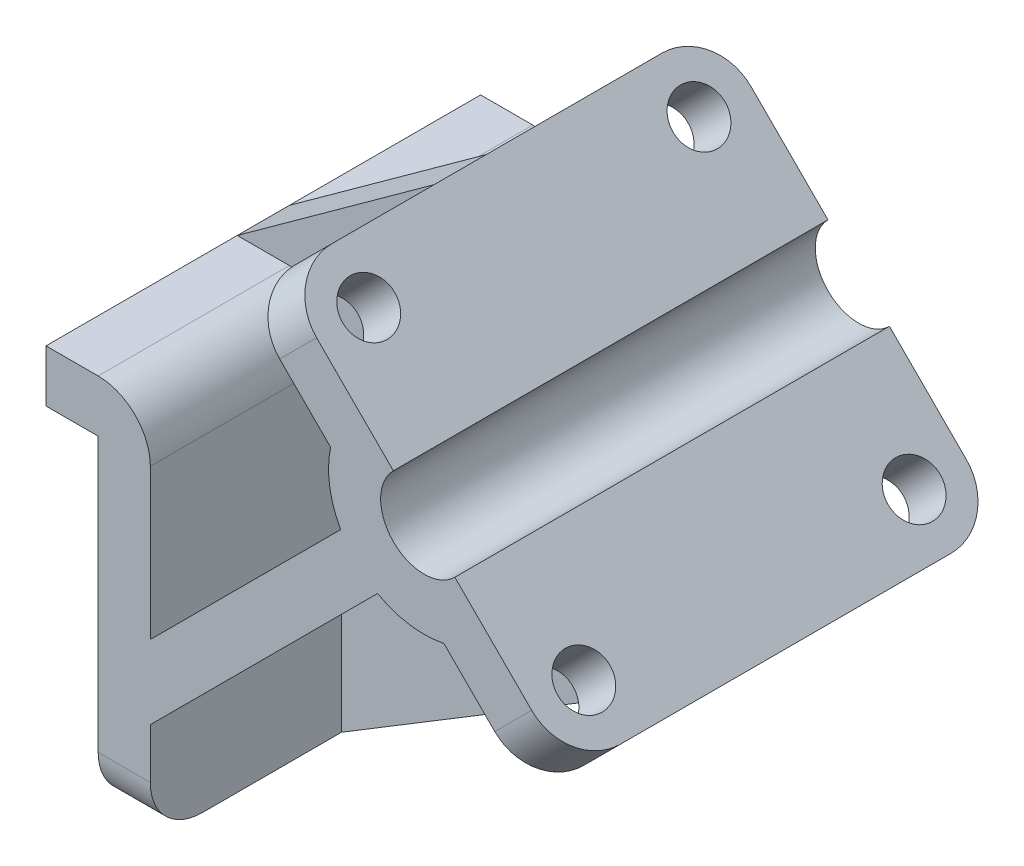
from build123d import *

# Parameters (mm, degrees)
BOSS_EXTRUDE1_DEPTH = 50
SKETCH2_R           = 6
CUT_EXTRUDE1_DEPTH  = 12
FILLET1_R           = 12
FILLET2_R           = 12
RIB3_REACH          = 169.943
SKETCH14_WALL_W     = 393.768799168
SKETCH14_WALL_H     = 12
RIB5_REACH          = 169.943
SKETCH15_WALL_W     = 440.544630956
SKETCH15_WALL_H     = 12


with BuildPart() as part:
    # Sketch1 → Boss-Extrude1 (new, symmetric)
    with BuildSketch(Plane.XY):
        with BuildLine():
            Line((0, 0), (-12, 0))
            Line((-12, 0), (-12, 75))
            Line((-12, 75), (-24, 75))
            Line((-24, 75), (-24, 87))
            Line((-24, 87), (-12, 87))
            ThreePointArc((-12, 87), (-3.514718626, 83.485281374), (0, 75))
            Line((0, 75), (0, 40.485281374))
            Line((0, 40.485281374), (43.790729766, 84.27601114))
            ThreePointArc((43.790729766, 84.27601114), (41.248196059, 91.704696476), (41.476313815, 99.553123436))
            Line((41.476313815, 99.553123436), (21.28069991, 119.748737342))
            Line((21.28069991, 119.748737342), (29.765981284, 128.234018716))
            Line((29.765981284, 128.234018716), (55.928932188, 102.071067812))
            ThreePointArc((55.928932188, 102.071067812), (55.928932188, 87.928932188), (70.071067812, 87.928932188))
            Line((70.071067812, 87.928932188), (96.234018716, 61.765981284))
            Line((96.234018716, 61.765981284), (87.748737342, 53.28069991))
            Line((87.748737342, 53.28069991), (67.553123436, 73.476313815))
            ThreePointArc((67.553123436, 73.476313815), (59.704696476, 73.248196059), (52.27601114, 75.790729766))
            Line((52.27601114, 75.790729766), (0, 23.514718626))
            Line((0, 23.514718626), (0, 0))
        make_face()
    extrude(amount=BOSS_EXTRUDE1_DEPTH, both=True)

    # Sketch2 → Cut-Extrude1 (cut)
    with BuildSketch(Plane(origin=(79, 79, 0), x_dir=(0, 0, -1), z_dir=(0.7071067811865508, 0.7071067811865444, 0))):
        with Locations(Location((-38, 57.627416998, 0), (0, 0, 90))):
            Circle(SKETCH2_R)
        with Locations(Location((38, 57.627416998, 0), (0, 0, 90))):
            Circle(SKETCH2_R)
        with Locations(Location((38, -12.372583002, 0), (0, 0, 90))):
            Circle(SKETCH2_R)
        with Locations(Location((-38, -12.372583002, 0), (0, 0, 90))):
            Circle(SKETCH2_R)
    extrude(amount=-CUT_EXTRUDE1_DEPTH, mode=Mode.SUBTRACT)

    # Fillet1
    fillet1_edges = [part.edges().sort_by_distance(p)[0] for p in [
        (91.991378029, 57.523340597, 50),
        (25.523340597, 123.991378029, -50),
        (91.991378029, 57.523340597, -50),
        (25.523340597, 123.991378029, 50),
    ]]
    fillet(fillet1_edges, radius=FILLET1_R)

    # Fillet2
    fillet2_edges = [part.edges().sort_by_distance(p)[0] for p in [
        (-6, 0, -50),
        (-6, 0, 50),
    ]]
    fillet(fillet2_edges, radius=FILLET2_R)

    # Sketch14 wall → Rib3 (add, up to next)
    with BuildSketch(Plane(origin=(-1.359650045, 103.374368671, 0), x_dir=(-0.810288257242, -0.586031518074, 0), z_dir=(0.586031518074, -0.810288257242, 0)), mode=Mode.PRIVATE) as rib3_sk1:
        Rectangle(SKETCH14_WALL_W, SKETCH14_WALL_H)
    rib3_tool1 = extrude(rib3_sk1.sketch, amount=RIB3_REACH, mode=Mode.PRIVATE) - part.part
    add(rib3_tool1.solids().sort_by_distance((-1.359650045, 103.374368671, 0))[0])

    # Sketch15 wall → Rib5 (add, up to next)
    with BuildSketch(Plane(origin=(43.874368671, 26.640349955, 0), x_dir=(-0.854767287398, -0.519011449193, 0), z_dir=(0.519011449193, -0.854767287398, 0)), mode=Mode.PRIVATE) as rib5_sk1:
        Rectangle(SKETCH15_WALL_W, SKETCH15_WALL_H)
    rib5_tool1 = extrude(rib5_sk1.sketch, amount=-RIB5_REACH, mode=Mode.PRIVATE) - part.part
    add(rib5_tool1.solids().sort_by_distance((43.874368671, 26.640349955, 0))[0])


solid = part.part
